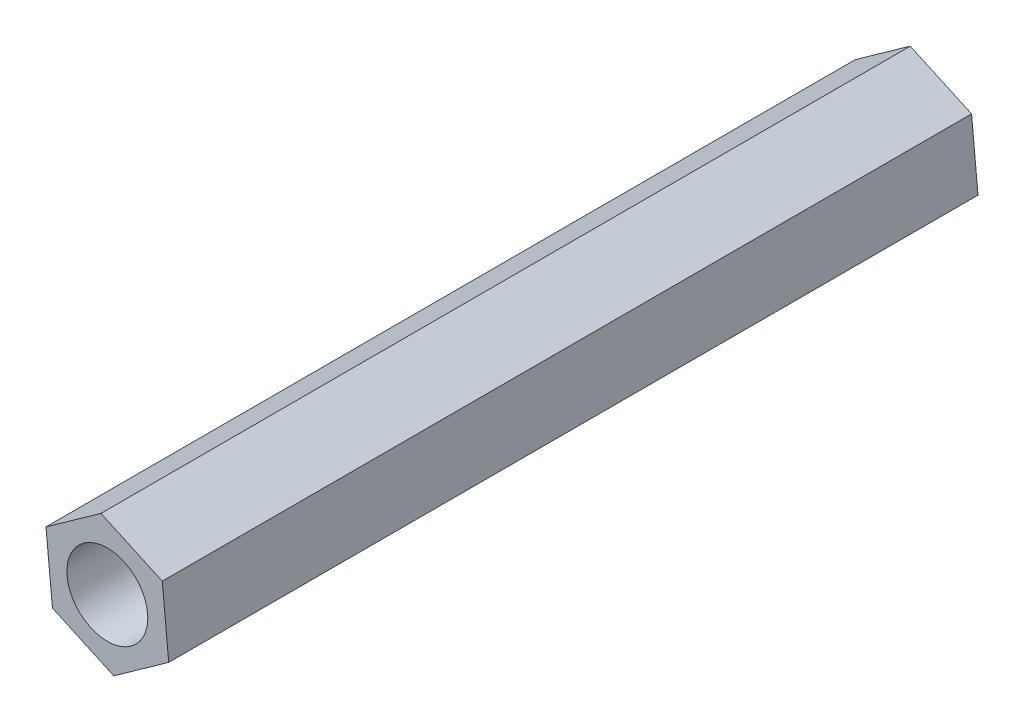
from build123d import *

# Parameters (mm, degrees)
SKETCH1_R           = 1.5
BOSS_EXTRUDE1_DEPTH = 30


with BuildPart() as part:
    # Sketch1 → Boss-Extrude1 (new body)
    with BuildSketch(Plane.XY):
        Polygon((2.036416368, 1.450175292), (-0.237680459, 2.488675953), (-2.274096827, 1.038500661), (-2.036416368, -1.450175292), (0.237680459, -2.488675953), (2.274096827, -1.038500661), align=None)
        Circle(SKETCH1_R, mode=Mode.SUBTRACT)
    extrude(amount=BOSS_EXTRUDE1_DEPTH)


solid = part.part
